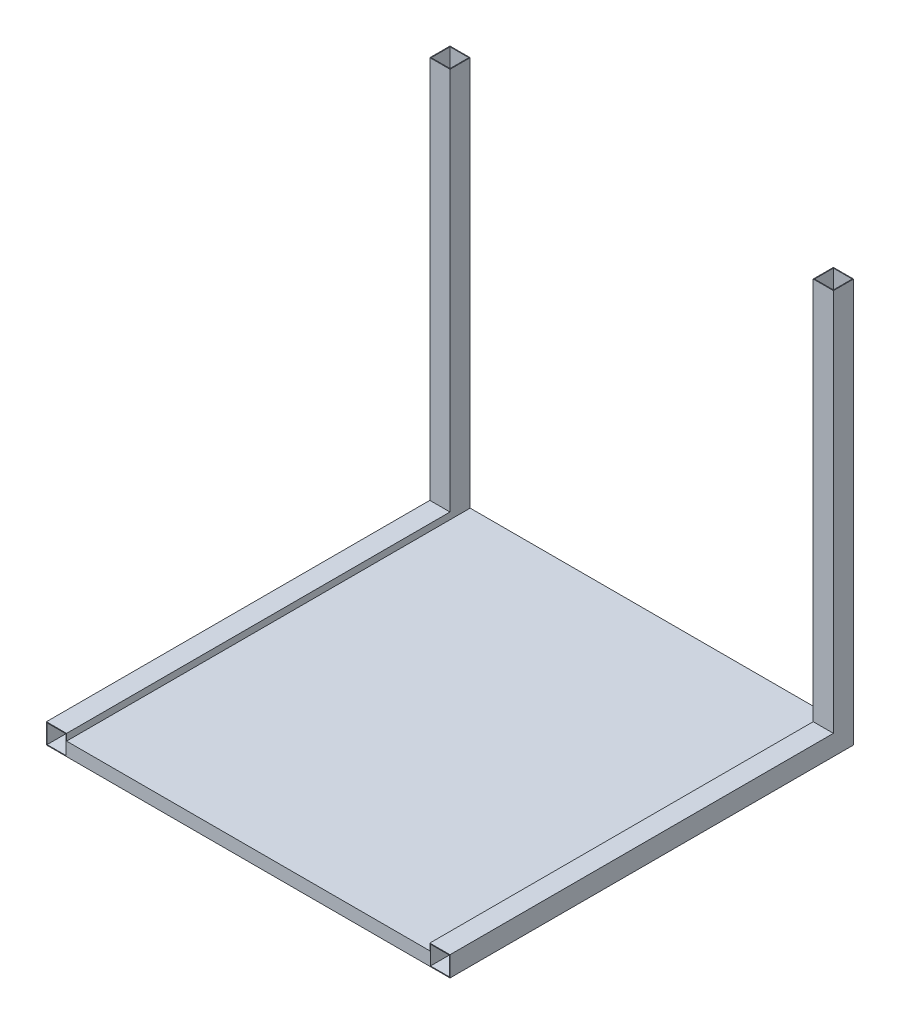
from build123d import *

# Parameters (mm, degrees)
SKETCH1_W                  = 30
SKETCH1_H                  = 30
SKETCH1_W_2                = 28
SKETCH1_H_2                = 28
EXTRUDE_THIN1_DEPTH        = 570
EXTRUDE_THIN1_2_DEPTH      = 570
EXTRUDE_THIN2_DEPTH        = 570
EXTRUDE_THIN2_DEPTH_BACK   = 30
SKETCH3_W                  = 30
SKETCH3_H                  = 30
SKETCH3_W_2                = 28
SKETCH3_H_2                = 28
EXTRUDE_THIN2_2_DEPTH      = 570
EXTRUDE_THIN2_2_DEPTH_BACK = 30
BOSS_EXTRUDE1_DEPTH        = 540
SKETCH5_W                  = 130
SKETCH5_H                  = 100
BOSS_EXTRUDE2_DEPTH        = 10


with BuildPart() as part:
    # Sketch1 → Extrude-Thin1 (new body)
    with BuildSketch(Plane.XY):
        with Locations((-285, 15)):
            Rectangle(SKETCH1_W, SKETCH1_H)
        with Locations((-285, 15)):
            Rectangle(SKETCH1_W_2, SKETCH1_H_2, mode=Mode.SUBTRACT)
    extrude(amount=-EXTRUDE_THIN1_DEPTH)



with BuildPart() as body_2:
    # Sketch1 → Extrude-Thin1 2 (new body)
    with BuildSketch(Plane.XY):
        with Locations((285, 15)):
            Rectangle(SKETCH1_W, SKETCH1_H)
        with Locations((285, 15)):
            Rectangle(SKETCH1_W_2, SKETCH1_H_2, mode=Mode.SUBTRACT)
    extrude(amount=-EXTRUDE_THIN1_2_DEPTH)


with BuildPart() as body_3:
    # Sketch3 → Extrude-Thin2 (new, two sides: drawn at the far end of the back side and taken through both)
    with BuildSketch(Plane(origin=(0, 30, 0), x_dir=(1, 0, 0), z_dir=(0, 1, 0)).offset(-EXTRUDE_THIN2_DEPTH_BACK)):
        with Locations((-285, 585)):
            Rectangle(SKETCH3_W, SKETCH3_H)
        with Locations((-285, 585)):
            Rectangle(SKETCH3_W_2, SKETCH3_H_2, mode=Mode.SUBTRACT)
    extrude(amount=EXTRUDE_THIN2_DEPTH + EXTRUDE_THIN2_DEPTH_BACK)


with BuildPart() as body_4:
    # Sketch3 → Extrude-Thin2 2 (new, two sides: drawn at the far end of the back side and taken through both)
    with BuildSketch(Plane(origin=(0, 30, 0), x_dir=(1, 0, 0), z_dir=(0, 1, 0)).offset(-EXTRUDE_THIN2_2_DEPTH_BACK)):
        with Locations((285, 585)):
            Rectangle(SKETCH3_W, SKETCH3_H)
        with Locations((285, 585)):
            Rectangle(SKETCH3_W_2, SKETCH3_H_2, mode=Mode.SUBTRACT)
    extrude(amount=EXTRUDE_THIN2_2_DEPTH + EXTRUDE_THIN2_2_DEPTH_BACK)


with BuildPart() as part_1:
    add(part.part)

    add(body_2.part)  # Boss-Extrude1 merges body 2

    add(body_3.part)  # Boss-Extrude1 merges body 3

    add(body_4.part)  # Boss-Extrude1 merges body 4
    # Sketch4 → Boss-Extrude1 (add)
    with BuildSketch(Plane(origin=(-270, 0, 0), x_dir=(0, 0, -1), z_dir=(1, 0, 0))):
        Polygon((600, 0), (600, 20), (570, 20), (0, 20), (0, 0), (570, 0), align=None)
    extrude(amount=BOSS_EXTRUDE1_DEPTH)

    # Sketch5 → Boss-Extrude2 (add)
    with BuildSketch(Plane(origin=(0, 0, 0), x_dir=(-1, 0, 0), z_dir=(0, -1, 0))):
        with Locations((-185, 500)):
            Rectangle(SKETCH5_W, SKETCH5_H)
        with Locations((185, 500)):
            Rectangle(SKETCH5_W, SKETCH5_H)
        with Locations((185, 100)):
            Rectangle(SKETCH5_W, SKETCH5_H)
        with Locations((-185, 100)):
            Rectangle(SKETCH5_W, SKETCH5_H)
    extrude(amount=BOSS_EXTRUDE2_DEPTH)


solid = part_1.part
